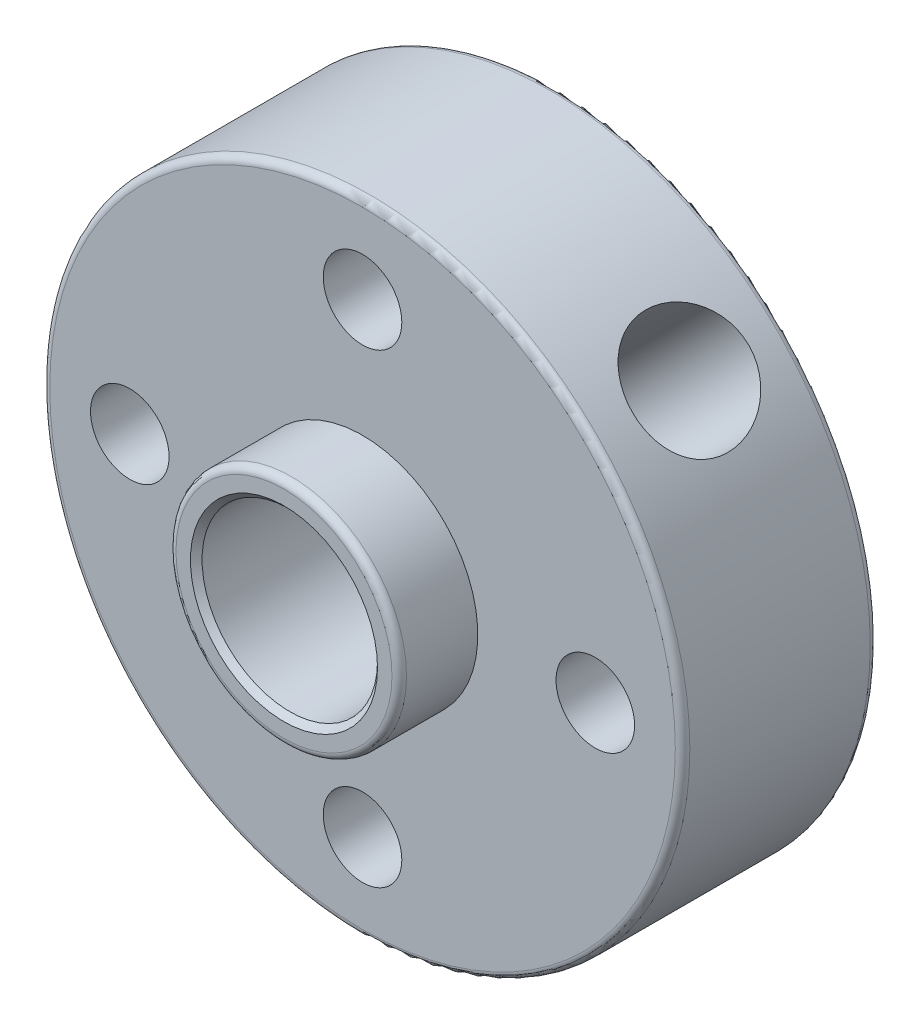
from build123d import *

# Parameters (mm, degrees)
SKETCH1_R           = 11
BOSS_EXTRUDE1_DEPTH = 6.7
SKETCH2_R           = 3.9625
BOSS_EXTRUDE2_DEPTH = 2.7
SKETCH3_R           = 3.015
CUT_EXTRUDE1_DEPTH  = 19.175808098
SKETCH4_R           = 1.35
CUT_EXTRUDE2_DEPTH  = 17.937827488
SKETCH6_R           = 2
CUT_EXTRUDE3_DEPTH  = 17.937827488
CHAMFER1_SIZE       = 0.2
FILLET1_R           = 0.25


with BuildPart() as part:
    # Sketch1 → Boss-Extrude1 (new body)
    with BuildSketch(Plane.XY):
        Circle(SKETCH1_R)
    extrude(amount=-BOSS_EXTRUDE1_DEPTH)

    # Sketch2 → Boss-Extrude2 (add)
    with BuildSketch(Plane.XY):
        with Locations(Location((0, 0, 0), (0, 0, 180))):
            Circle(SKETCH2_R)
    extrude(amount=BOSS_EXTRUDE2_DEPTH)

    # Sketch3 → Cut-Extrude1 (cut, through all)
    with BuildSketch(Plane.XY.offset(2.7)):
        Circle(SKETCH3_R)
    extrude(amount=-CUT_EXTRUDE1_DEPTH, mode=Mode.SUBTRACT)

    # Sketch4 → Cut-Extrude2 (cut, through all)
    with BuildSketch(Plane.XY):
        with Locations((0, 8)):
            Circle(SKETCH4_R)
        with Locations((8, 0)):
            Circle(SKETCH4_R)
        with Locations((0, -8)):
            Circle(SKETCH4_R)
        with Locations((-8, 0)):
            Circle(SKETCH4_R)
    extrude(amount=-CUT_EXTRUDE2_DEPTH, mode=Mode.SUBTRACT)

    # Sketch6 → Cut-Extrude3 (cut, through all)
    with BuildSketch(Plane(origin=(0, 0, 0), x_dir=(0, 0, 1), z_dir=(-0.7071067811865487, -0.7071067811865465, 0))):
        with Locations(Location((-3.5, 0, 0), (0, 0, 270))):
            Circle(SKETCH6_R)
    extrude(amount=-CUT_EXTRUDE3_DEPTH, mode=Mode.SUBTRACT)

    # Chamfer1
    chamfer1_edges = [part.edges().sort_by_distance(p)[0] for p in [
        (-3.015, 0, -6.7),
        (-3.015, 0, 2.7),
    ]]
    chamfer(chamfer1_edges, length=CHAMFER1_SIZE)

    # Fillet1
    fillet1_edges = [part.edges().sort_by_distance(p)[0] for p in [
        (-11, 0, 0),
        (-11, 0, -6.7),
        (3.9625, 0, 2.7),
    ]]
    fillet(fillet1_edges, radius=FILLET1_R)


solid = part.part
